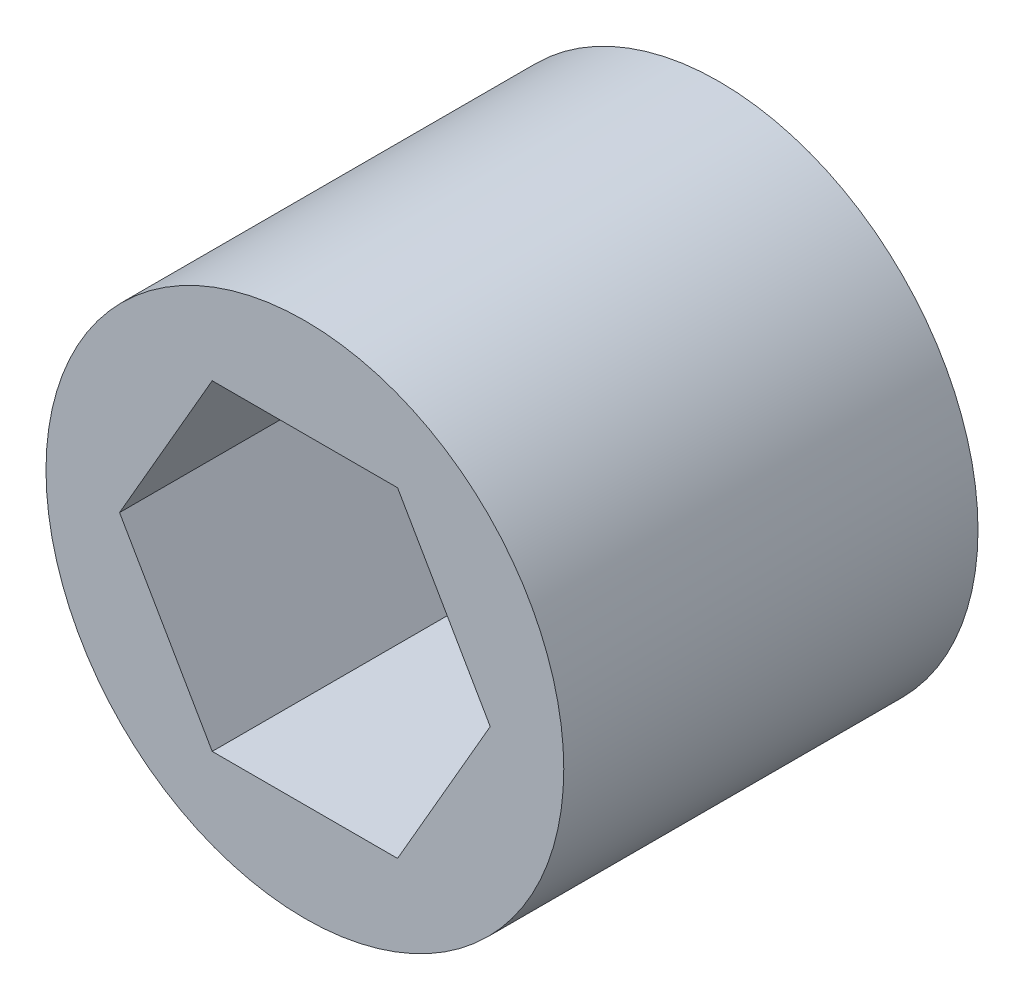
from build123d import *

# Parameters (mm, degrees)
SKETCH1_R           = 5
SKETCH1_R_2         = 1.725
BOSS_EXTRUDE1_DEPTH = 8
CUT_EXTRUDE1_DEPTH  = 5.3


with BuildPart() as part:
    # Sketch1 → Boss-Extrude1 (new body)
    with BuildSketch(Plane.XY):
        Circle(SKETCH1_R)
        Circle(SKETCH1_R_2, mode=Mode.SUBTRACT)
    extrude(amount=BOSS_EXTRUDE1_DEPTH)

    # Sketch2 → Cut-Extrude1 (cut)
    with BuildSketch(Plane.XY.offset(8)):
        Polygon((3.579571669, 0), (1.789785834, 3.1), (-1.789785834, 3.1), (-3.579571669, 0), (-1.789785834, -3.1), (1.789785834, -3.1), align=None)
    extrude(amount=-CUT_EXTRUDE1_DEPTH, mode=Mode.SUBTRACT)


solid = part.part
